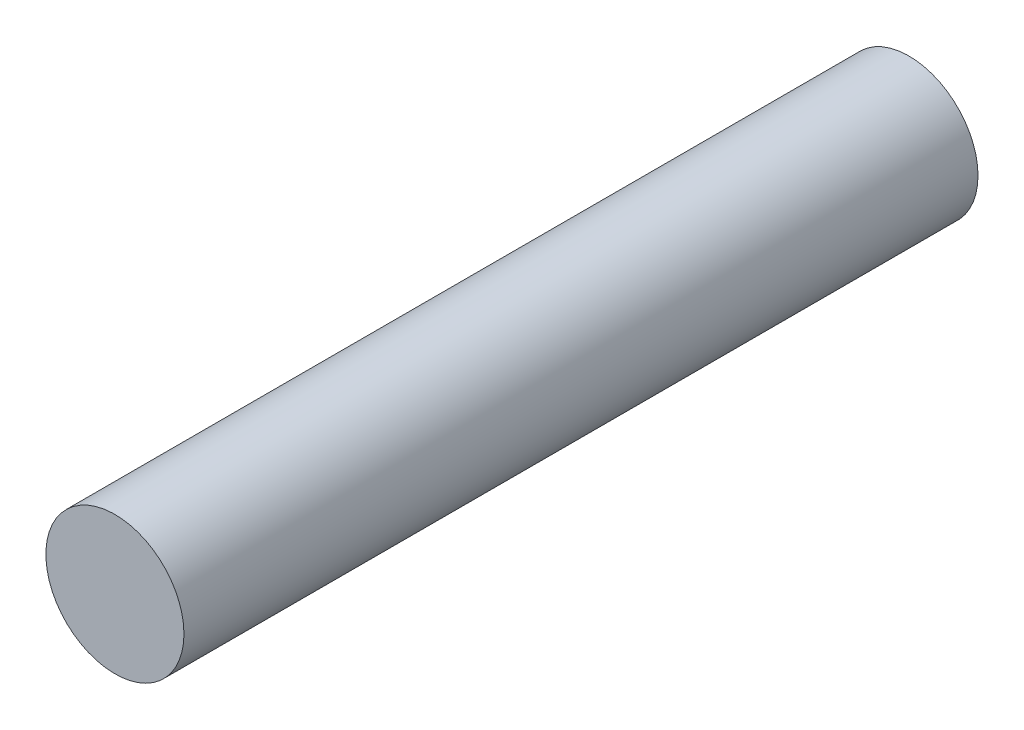
from build123d import *

# Parameters (mm, degrees)
SKETCH1_R           = 10
BOSS_EXTRUDE1_DEPTH = 115


with BuildPart() as part:
    # Sketch1 → Boss-Extrude1 (new body)
    with BuildSketch(Plane.XY):
        Circle(SKETCH1_R)
    extrude(amount=BOSS_EXTRUDE1_DEPTH)


solid = part.part
